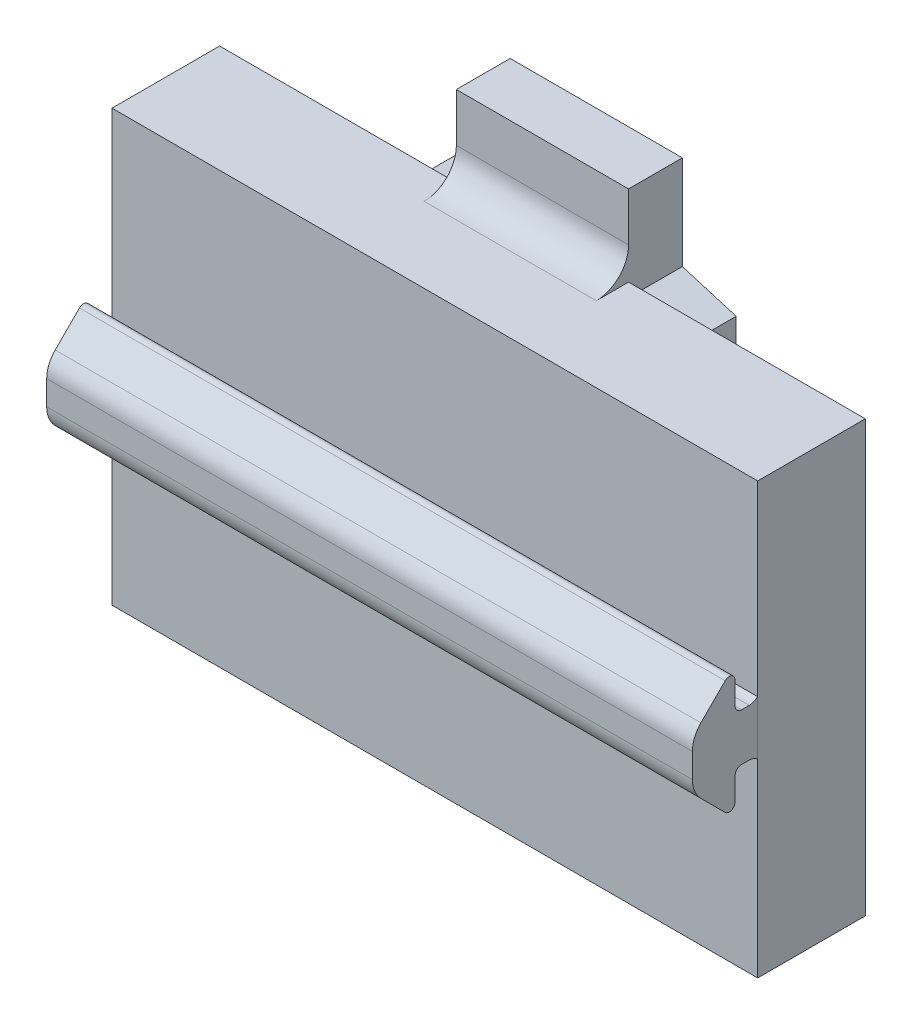
from build123d import *

# Parameters (mm, degrees)
BOSS_EXTRUDE1_DEPTH = 2.5
SKETCH3_W           = 60
SKETCH3_H           = 40
BOSS_EXTRUDE2_DEPTH = 10
BOSS_EXTRUDE3_DEPTH = 60
FILLET4_R           = 3


with BuildPart() as part:
    # Sketch2 → Boss-Extrude1 (new, symmetric)
    with BuildSketch(Plane.XY):
        Polygon((-8, -27.5), (8, -27.5), (8, -18.75), (13, -17.25), (13, -10.25), (8, -8.75), (8, 8.75), (13, 10.25), (13, 17.25), (8, 18.75), (8, 27.5), (-8, 27.5), (-8, 18.75), (-13, 17.25), (-13, 10.25), (-8, 8.75), (-8, -8.75), (-13, -10.25), (-13, -17.25), (-8, -18.75), align=None)
    extrude(amount=BOSS_EXTRUDE1_DEPTH, both=True)

    # Sketch3 → Boss-Extrude2 (add)
    with BuildSketch(Plane.XY.offset(2.5)):
        Rectangle(SKETCH3_W, SKETCH3_H)
    extrude(amount=BOSS_EXTRUDE2_DEPTH)

    # Fillet4
    fillet4_edges = [part.edges().sort_by_distance(p)[0] for p in [
        (0, -20, 2.5),
        (0, 20, 2.5),
    ]]
    fillet(fillet4_edges, radius=FILLET4_R)


with BuildPart() as body_2:
    # Sketch5 → Boss-Extrude3 (new, through all)
    with BuildSketch(Plane(origin=(30, 0, 0), x_dir=(0, 0, -1), z_dir=(1, 0, 0))):
        with BuildLine():
            ThreePointArc((-14.6034, 5.0471626), (-14.935639777, 5.544394565), (-15.52216487, 5.42772747))
            Line((-15.52216487, 5.42772747), (-17.777002218, 3.172890121))
            ThreePointArc((-17.777002218, 3.172890121), (-18.361681683, 2.297855465), (-18.566993808, 1.265681711))
            Line((-18.566993808, 1.265681711), (-18.566993808, -1.001156511))
            ThreePointArc((-18.566993808, -1.001156511), (-18.361681683, -2.033330264), (-17.777002218, -2.908364921))
            Line((-17.777002218, -2.908364921), (-15.52216487, -5.163202269))
            ThreePointArc((-15.52216487, -5.163202269), (-14.935639777, -5.279869364), (-14.6034, -4.7826374))
            Line((-14.6034, -4.7826374), (-14.6034, -2.6744374))
            ThreePointArc((-14.6034, -2.6744374), (-14.426258181, -2.246779218), (-13.9986, -2.0696374))
            Line((-13.9986, -2.0696374), (-13.2874, -2.0696374))
            ThreePointArc((-13.2874, -2.0696374), (-12.871270036, -2.152410796), (-12.518492086, -2.388129486))
            Line((-12.518492086, -2.388129486), (-12.518492086, 2.652654686))
            ThreePointArc((-12.518492086, 2.652654686), (-12.871270036, 2.416935997), (-13.2874, 2.3341626))
            Line((-13.2874, 2.3341626), (-13.9986, 2.3341626))
            ThreePointArc((-13.9986, 2.3341626), (-14.426258181, 2.511304419), (-14.6034, 2.9389626))
            Line((-14.6034, 2.9389626), (-14.6034, 5.0471626))
        make_face()
    extrude(amount=-BOSS_EXTRUDE3_DEPTH)


solid = Compound([part.part, body_2.part])
